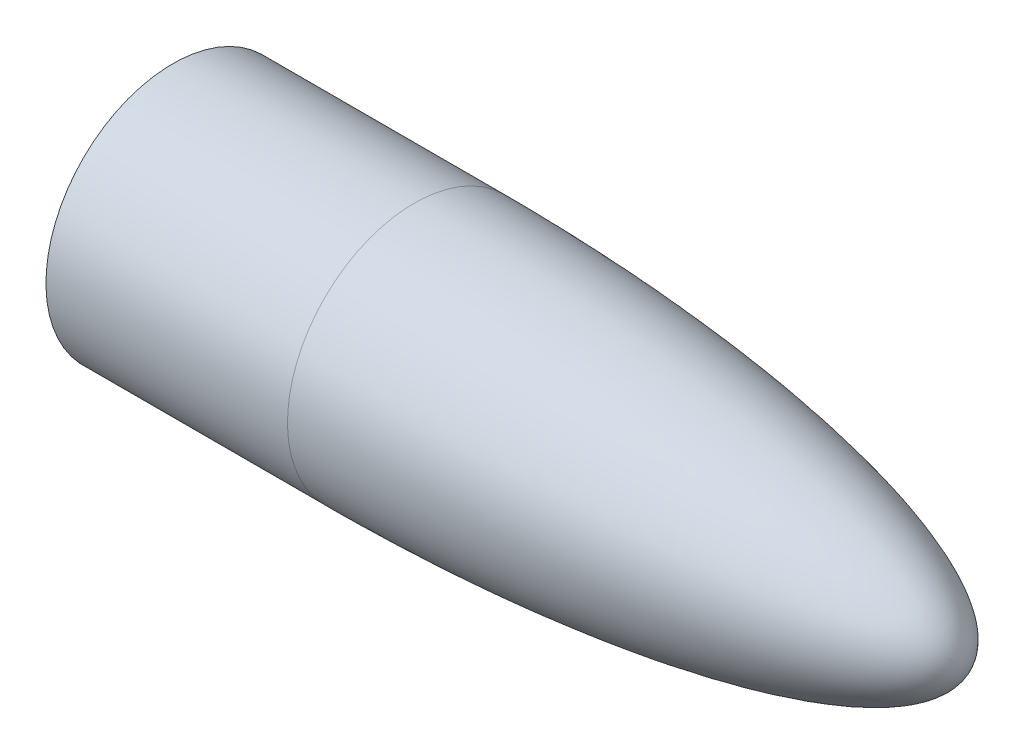
from build123d import *


with BuildPart() as part:
    # Sketch1 → Revolve1 (revolve)
    with BuildSketch(Plane.XY, mode=Mode.PRIVATE) as revolve1_sk:
        with BuildLine():
            Line((114, 0), (115.27, 0))
            Line((115.27, 0), (115.26996208, 0.021973433))
            add(Edge.make_bspline(
                [(0, 26.67), (0.295354458, 26.67), (0.868983227, 26.66941741), (1.831904676, 26.666798189), (2.840343064, 26.662432751), (4.136936467, 26.654275379), (5.647424138, 26.639707807), (7.588730111, 26.615226215), (9.458118542, 26.583695383), (11.991635692, 26.532279342), (16.399470903, 26.417462242), (22.712115228, 26.18191259), (32.794046445, 25.647356331), (45.384817129, 24.670801838), (57.936455602, 23.225275941), (67.938040942, 21.718747093), (75.41155088, 20.384640287), (82.846450521, 18.806182969), (90.223942402, 16.919680073), (96.29702924, 15.005638371), (101.072295325, 13.165231742), (104.591956457, 11.58179534), (108.012975592, 9.718390964), (110.722819961, 7.8190975), (112.695237925, 5.942577677), (114.003600012, 4.286442925), (114.996921855, 2.317807267), (115.267132927, 0.786379994), (115.269956101, 0.023784832), (115.26996208, 0.021973433)],
                knots=[0.086204077, 0.086204077, 0.086204077, 0.086204077, 0.093343108, 0.100482139, 0.107621169, 0.1147602, 0.129038261, 0.143316322, 0.157594384, 0.171872445, 0.200428568, 0.257540813, 0.314653058, 0.428877548, 0.543102039, 0.600214284, 0.657326529, 0.714438774, 0.771551019, 0.828663264, 0.857219387, 0.88577551, 0.914331632, 0.942887755, 0.957165816, 0.971443877, 0.985721939, 0.999832185, 0.999865748, 0.999865748, 0.999865748, 0.999865748], degree=3))
            Line((0, 26.67), (-50.8, 26.67))
            Line((-50.8, 26.67), (-50.8, 25.4))
            Line((-50.8, 25.4), (0, 25.4))
            add(Edge.make_bspline(
                [(0, 25.4), (0.49269448, 25.4), (1.490098077, 25.398484872), (3.338339889, 25.391666791), (5.335077938, 25.37347611), (7.580908538, 25.34616729), (9.685510429, 25.30971268), (11.871452621, 25.264075563), (14.011632834, 25.20920908), (16.714589667, 25.129019532), (19.942494363, 25.01408762), (23.716532499, 24.852389019), (28.022252468, 24.62892938), (32.328780776, 24.365826132), (36.630857375, 24.061870368), (40.930781301, 23.71562031), (45.226339878, 23.325327169), (50.590648235, 22.779847576), (55.946054364, 22.153390774), (61.290642422, 21.438688891), (67.686848861, 20.462439889), (72.999857656, 19.541334625), (78.290230775, 18.496727889), (84.600566277, 17.065070336), (90.302704774, 15.573641525), (95.932900365, 13.820528014), (101.217440057, 11.765494712), (104.964602481, 9.974804769), (107.603951185, 8.4451727), (109.523381846, 7.096252361), (110.883463267, 5.939602372), (111.852292617, 4.943926114), (112.562293701, 4.057061214), (113.081208047, 3.256924445), (113.460924161, 2.511253808), (113.726436918, 1.810850235), (113.910279086, 1.103573173), (113.982356417, 0.569281783), (113.999961621, 0.206370755), (114, 0)],
                knots=[0.086204077, 0.086204077, 0.086204077, 0.086204077, 0.086204077, 0.102511123, 0.118818168, 0.135125214, 0.151432259, 0.167739305, 0.18404635, 0.200353396, 0.216660441, 0.249274532, 0.281888623, 0.314502713, 0.347116804, 0.379730895, 0.412344986, 0.444959077, 0.477573167, 0.542801347, 0.575415439, 0.60802953, 0.673257706, 0.705871798, 0.73848589, 0.803714042, 0.851475928, 0.884090031, 0.909828041, 0.929203957, 0.943631647, 0.954949691, 0.963750033, 0.971157964, 0.977938718, 0.983743417, 0.989009737, 0.993767869, 1, 1, 1, 1, 1], degree=4))
        make_face()
    revolve(revolve1_sk.sketch.rotate(Axis((-36.606300059, 0, 0), (1, 0, 0)), 180), axis=Axis((-36.606300059, 0, 0), (1, 0, 0)))


solid = part.part
